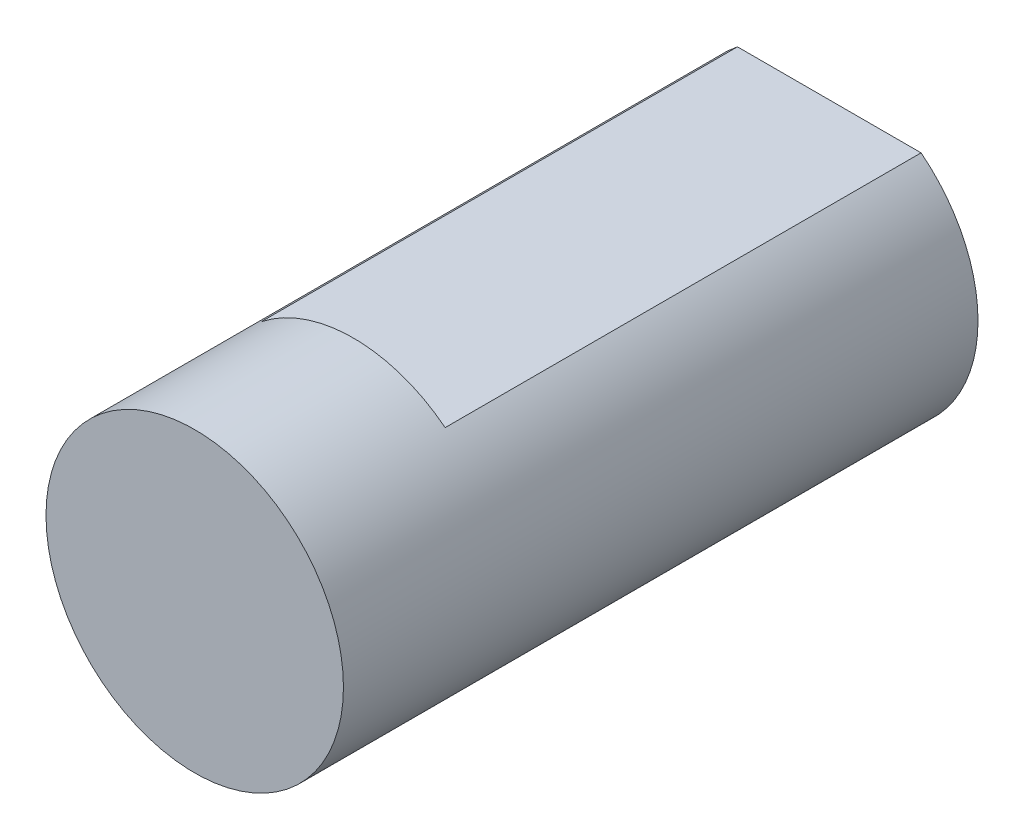
from build123d import *
from build123d.topology import SkipClean

# Parameters (mm, degrees)
EXTRUDE1_DEPTH              = 30.48
EXTRUDE2_START              = 25.4
SKETCH2_R                   = 9.525
EXTRUDE2_DEPTH              = 25.4
F_1_2_13_TAPPED_HOLE1_D     = 10.71626
F_1_2_13_TAPPED_HOLE1_DEPTH = 31.25978
F_1_2_13_TAPPED_HOLE1_TIP   = 3.219489309
SKETCH6_R                   = 9.525
CUT_EXTRUDE1_DEPTH          = 15.24


with BuildPart() as part:
    # Sketch1 → Extrude1 (new body)
    with BuildSketch(Plane.XY):
        with BuildLine():
            Line((-5.880525147, 7.493), (5.880525147, 7.493))
            ThreePointArc((5.880525147, 7.493), (9.525, 0), (5.880525147, -7.493))
            Line((5.880525147, -7.493), (-5.880525147, -7.493))
            ThreePointArc((-5.880525147, -7.493), (-9.525, 0), (-5.880525147, 7.493))
        make_face()
    extrude(amount=-EXTRUDE1_DEPTH)

    # Sketch2 → Extrude2 (add)
    with SkipClean():  # the faces are left unmerged after this step: merging them gives an invalid solid
        with BuildSketch(Plane.XY.offset(EXTRUDE2_START)):
            Circle(SKETCH2_R)
        extrude(amount=-EXTRUDE2_DEPTH)

    # 1/2-13 Tapped Hole1
    with Locations(Plane(origin=(0, 0, -30.48), x_dir=(-1, 0, 0), z_dir=(0, 0, -1))):
        with Locations((0, 0)):
            Hole(F_1_2_13_TAPPED_HOLE1_D / 2, depth=F_1_2_13_TAPPED_HOLE1_DEPTH)
            with Locations((0, 0, -(F_1_2_13_TAPPED_HOLE1_DEPTH + F_1_2_13_TAPPED_HOLE1_TIP / 2))):  # 118° drill point
                Cone(0, F_1_2_13_TAPPED_HOLE1_D / 2, F_1_2_13_TAPPED_HOLE1_TIP, mode=Mode.SUBTRACT)

    # Sketch6 → Cut-Extrude1 (cut)
    with SkipClean():  # the faces are left unmerged after this step: merging them gives an invalid solid
        with BuildSketch(Plane.XY.offset(25.4)):
            Circle(SKETCH6_R)
        extrude(amount=-CUT_EXTRUDE1_DEPTH, mode=Mode.SUBTRACT)


solid = part.part
